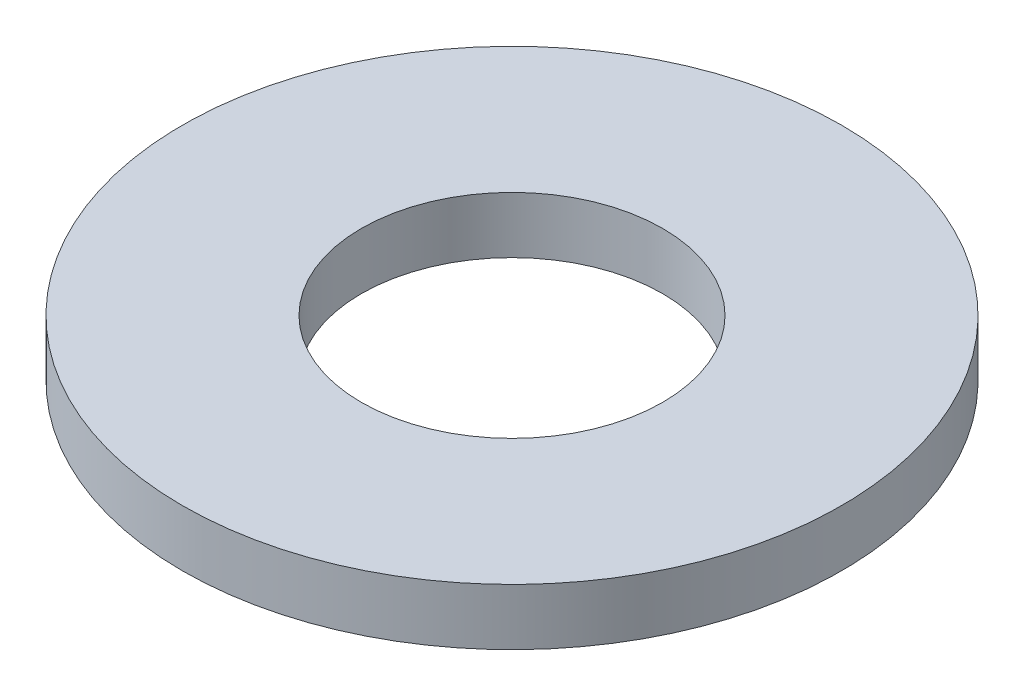
from build123d import *

# Parameters (mm, degrees)
SKETCH1_R           = 7
BOSS_EXTRUDE1_DEPTH = 1.2
SKETCH2_R           = 3.2
CUT_EXTRUDE1_DEPTH  = 10.97196069


with BuildPart() as part:
    # Sketch1 → Boss-Extrude1 (new body)
    with BuildSketch(Plane(origin=(0, 0, 0), x_dir=(1, 0, 0), z_dir=(0, 1, 0))):
        with Locations(Location((0, 0, 0), (0, 0, 270))):
            Circle(SKETCH1_R)
    extrude(amount=BOSS_EXTRUDE1_DEPTH)

    # Sketch2 → Cut-Extrude1 (cut, through all)
    with BuildSketch(Plane(origin=(0, 1.2, 0), x_dir=(1, 0, 0), z_dir=(0, 1, 0))):
        with Locations(Location((0, 0, 0), (0, 0, 270))):
            Circle(SKETCH2_R)
    extrude(amount=-CUT_EXTRUDE1_DEPTH, mode=Mode.SUBTRACT)


solid = part.part
